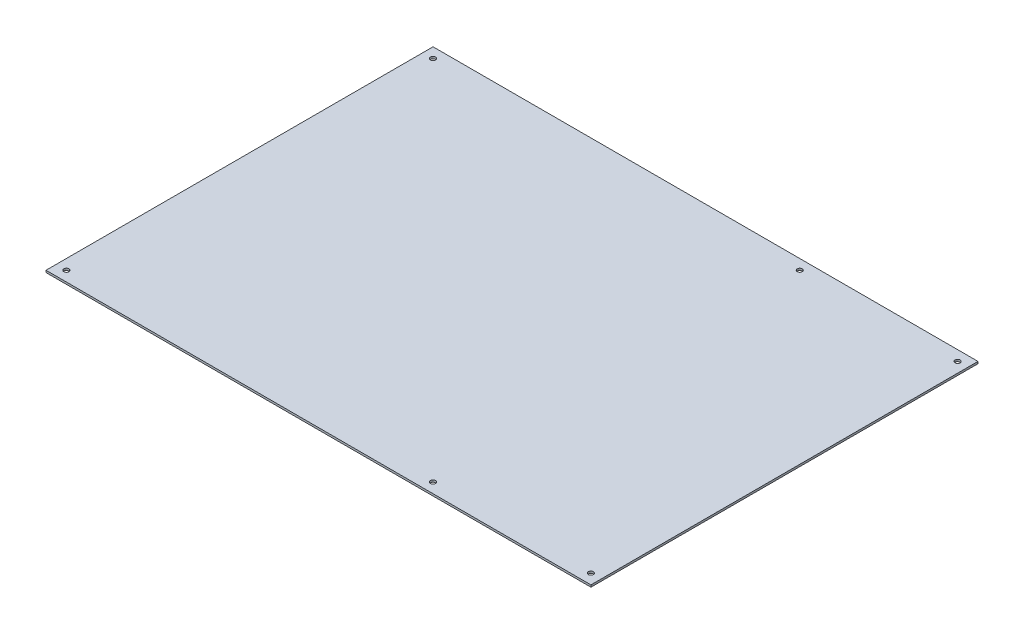
from build123d import *

# Parameters (mm, degrees)
SKICA1_W                = 535
SKICA1_H                = 380
SKICA1_R                = 2.5
P_IDAT_VYSUNUT_M1_DEPTH = 2


with BuildPart() as part:
    # Skica1 → Přidat vysunutím1 (new body)
    with BuildSketch(Plane(origin=(0, 0, 0), x_dir=(1, 0, 0), z_dir=(0, 1, 0))):
        Rectangle(SKICA1_W, SKICA1_H)
        with Locations(Location((-257.529345711, 180, 0), (0, 0, 270))):
            Circle(SKICA1_R, mode=Mode.SUBTRACT)
        with Locations(Location((-257.5, -180, 0), (0, 0, 270))):
            Circle(SKICA1_R, mode=Mode.SUBTRACT)
        with Locations(Location((102.5, -180, 0), (0, 0, 270))):
            Circle(SKICA1_R, mode=Mode.SUBTRACT)
        with Locations(Location((257.5, -180, 0), (0, 0, 270))):
            Circle(SKICA1_R, mode=Mode.SUBTRACT)
        with Locations(Location((102.5, 180, 0), (0, 0, 270))):
            Circle(SKICA1_R, mode=Mode.SUBTRACT)
        with Locations(Location((257.5, 180, 0), (0, 0, 270))):
            Circle(SKICA1_R, mode=Mode.SUBTRACT)
    extrude(amount=P_IDAT_VYSUNUT_M1_DEPTH)


solid = part.part
